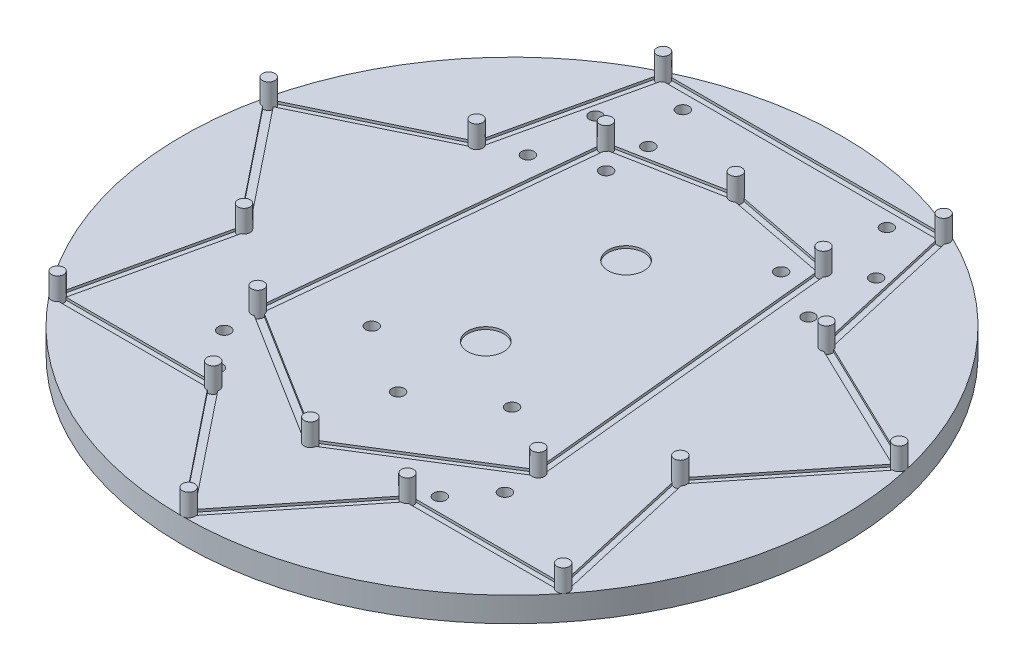
from build123d import *
from build123d.topology import SkipClean

# Parameters (mm, degrees)
SKETCH1_R           = 132.5
BOSS_EXTRUDE1_DEPTH = 10
SKETCH4_R           = 7.27
CUT_EXTRUDE2_DEPTH  = 1
CUT_EXTRUDE3_DEPTH  = 1
SKETCH6_R           = 2.5
BOSS_EXTRUDE2_DEPTH = 10
SKETCH7_R           = 133.4
BOSS_EXTRUDE3_DEPTH = 10
CUT_EXTRUDE4_START  = -1
SKETCH8_R           = 7.27
CUT_EXTRUDE4_DEPTH  = 1
SKETCH9_R           = 2.5
CUT_EXTRUDE5_DEPTH  = 10
CUT_EXTRUDE7_DEPTH  = 5


with BuildPart() as part:
    # Sketch1 → Boss-Extrude1 (new body)
    with BuildSketch(Plane(origin=(0, 0, 0), x_dir=(1, 0, 0), z_dir=(0, 1, 0))):
        with Locations(Location((0, 0, 0), (0, 0, 270))):
            Circle(SKETCH1_R)
    extrude(amount=-BOSS_EXTRUDE1_DEPTH)

    # Sketch4 → Cut-Extrude2 (cut)
    # profile 1 of 3: a face of its own
    with BuildSketch(Plane(origin=(0, 0, 0), x_dir=(1, 0, 0), z_dir=(0, 1, 0))):
        with BuildLine():
            Line((-0.5, -46.614501577), (-0.5, -123.363728943))
            ThreePointArc((-0.5, -123.363728943), (-26.039072114, -102.098724898), (-54.697575203, -118.92533484))
            ThreePointArc((-54.697575203, -118.92533484), (-54.449714233, -119.587577197), (-53.787471876, -119.339716227))
            ThreePointArc((-53.787471876, -119.339716227), (-22.483094979, -103.636494999), (-0.5, -130.9))
            ThreePointArc((-0.5, -130.9), (0, -131.4), (0.5, -130.9))
            ThreePointArc((0.5, -130.9), (22.483094979, -103.636494999), (53.787471876, -119.339716227))
            ThreePointArc((53.787471876, -119.339716227), (54.449714233, -119.587577197), (54.697575203, -118.92533484))
            ThreePointArc((54.697575203, -118.92533484), (26.039072114, -102.098724898), (0.5, -123.363728943))
            Line((0.5, -123.363728943), (0.5, -46.614501577))
            Line((0.5, -46.614501577), (56.79538145, -46.614501577))
            ThreePointArc((56.79538145, -46.614501577), (57.29538145, -46.114501577), (56.79538145, -45.614501577))
            Line((56.79538145, -45.614501577), (0.5, -45.614501577))
            Line((0.5, -45.614501577), (0.5, -11.112006373))
            ThreePointArc((0.5, -11.112006373), (51.771861801, 21.636640783), (44.671501815, 82.059009084))
            ThreePointArc((44.671501815, 82.059009084), (54.047347169, 98.919858711), (57.29538145, 117.936824808))
            ThreePointArc((57.29538145, 117.936824808), (56.79538145, 118.436824808), (56.29538145, 117.936824808))
            ThreePointArc((56.29538145, 117.936824808), (53.139078659, 99.351661589), (44.024097981, 82.850520221))
            ThreePointArc((44.024097981, 82.850520221), (0, 103.47657481), (-44.024097981, 82.850520221))
            ThreePointArc((-44.024097981, 82.850520221), (-53.139078659, 99.351661589), (-56.29538145, 117.936824808))
            ThreePointArc((-56.29538145, 117.936824808), (-56.79538145, 118.436824808), (-57.29538145, 117.936824808))
            ThreePointArc((-57.29538145, 117.936824808), (-54.047347169, 98.919858711), (-44.671501815, 82.059009084))
            ThreePointArc((-44.671501815, 82.059009084), (-51.771861801, 21.636640783), (-0.5, -11.112006373))
            Line((-0.5, -11.112006373), (-0.5, -45.614501577))
            Line((-0.5, -45.614501577), (-56.79538145, -45.614501577))
            ThreePointArc((-56.79538145, -45.614501577), (-57.29538145, -46.114501577), (-56.79538145, -46.614501577))
            Line((-56.79538145, -46.614501577), (-0.5, -46.614501577))
        make_face()
        with BuildLine():
            ThreePointArc((56.29538145, 46.18119336), (-18.585163219, -6.9578853), (-44.024097981, 81.267497947))
            ThreePointArc((-44.024097981, 81.267497947), (-43.704578003, 81.664708324), (-43.381474289, 82.059009084))
            ThreePointArc((-43.381474289, 82.059009084), (0, 102.47657481), (43.381474289, 82.059009084))
            ThreePointArc((43.381474289, 82.059009084), (43.704578003, 81.664708324), (44.024097981, 81.267497947))
            ThreePointArc((44.024097981, 81.267497947), (53.139078659, 64.766356579), (56.29538145, 46.18119336))
        make_face(mode=Mode.SUBTRACT)
    # profile 2 of 3: a face of its own
    with BuildSketch(Plane(origin=(0, 0, 0), x_dir=(1, 0, 0), z_dir=(0, 1, 0))):
        with BuildLine():
            ThreePointArc((-43.381474289, 82.059009084), (-43.704578003, 81.664708324), (-44.024097981, 81.267497947))
            ThreePointArc((-44.024097981, 81.267497947), (0, 60.641443358), (44.024097981, 81.267497947))
            ThreePointArc((44.024097981, 81.267497947), (43.704578003, 81.664708324), (43.381474289, 82.059009084))
            ThreePointArc((43.381474289, 82.059009084), (0, 61.641443358), (-43.381474289, 82.059009084))
        make_face()
    # profile 3 of 3: a face of its own
    with BuildSketch(Plane(origin=(0, 0, 0), x_dir=(1, 0, 0), z_dir=(0, 1, 0))):
        with Locations(Location((0, 46.18119336, 0), (0, 0, 270))):
            Circle(SKETCH4_R)
    extrude(amount=-CUT_EXTRUDE2_DEPTH, mode=Mode.SUBTRACT)

    # Sketch5 → Cut-Extrude3 (cut)
    # profile 1 of 8: a face of its own
    with BuildSketch(Plane(origin=(0, 0, 0), x_dir=(1, 0, 0), z_dir=(0, 1, 0))):
        with BuildLine():
            ThreePointArc((0.5, -130.9), (0.4233621, -131.166016038), (0.21694187, -131.350484434))
            Line((0.21694187, -131.350484434), (46.035485479, -109.285436761))
            ThreePointArc((46.035485479, -109.285436761), (45.600159712, -108.937390671), (45.157967719, -108.598110778))
            Line((45.157967719, -108.598110778), (1.756759395, -129.499031132))
            Line((1.756759395, -129.499031132), (22.359897198, -103.663513495))
            ThreePointArc((22.359897198, -103.663513495), (21.555744487, -103.854317914), (20.757596694, -104.068859305))
            Line((20.757596694, -104.068859305), (0.539181887, -129.421949563))
            ThreePointArc((0.539181887, -129.421949563), (0.523291896, -129.760246656), (0.511509831, -130.098711716))
            ThreePointArc((0.511509831, -130.098711716), (0.502877606, -130.499314528), (0.5, -130.9))
        make_face()
    # profile 2 of 8: a face of its own
    with BuildSketch(Plane(origin=(0, 0, 0), x_dir=(1, 0, 0), z_dir=(0, 1, 0))):
        with BuildLine():
            Line((-46.035485479, -109.285436761), (-0.21694187, -131.350484434))
            ThreePointArc((-0.21694187, -131.350484434), (-0.4233621, -131.166016038), (-0.5, -130.9))
            ThreePointArc((-0.5, -130.9), (-0.509797192, -130.160715157), (-0.539181887, -129.421949562))
            Line((-0.539181887, -129.421949562), (-20.757596693, -104.068859305))
            ThreePointArc((-20.757596693, -104.068859305), (-21.555744486, -103.854317915), (-22.359897197, -103.663513495))
            Line((-22.359897197, -103.663513495), (-1.756759395, -129.499031131))
            Line((-1.756759395, -129.499031131), (-45.157967718, -108.598110777))
            ThreePointArc((-45.157967718, -108.598110777), (-45.600159712, -108.93739067), (-46.035485479, -109.285436761))
        make_face()
    # profile 3 of 8: a face of its own
    with BuildSketch(Plane(origin=(0, 0, 0), x_dir=(1, 0, 0), z_dir=(0, 1, 0))):
        with BuildLine():
            ThreePointArc((46.167760692, -108.111820112), (46.600425974, -108.455914839), (47.026429874, -108.808223092))
            Line((47.026429874, -108.808223092), (102.558682925, -82.065299497))
            ThreePointArc((102.558682925, -82.065299497), (102.732656796, -81.926559964), (102.829205011, -81.72607553))
            Line((102.829205011, -81.72607553), (128.105527661, 29.016729788))
            ThreePointArc((128.105527661, 29.016729788), (128.105527661, 29.239250722), (128.008979446, 29.439735156))
            Line((128.008979446, 29.439735156), (57.186297192, 118.248569709))
            ThreePointArc((57.186297192, 118.248569709), (57.267323116, 118.101964339), (57.29538145, 117.936824808))
            ThreePointArc((57.29538145, 117.936824808), (57.262733912, 116.002906394), (57.164828504, 114.071191915))
            Line((57.164828504, 114.071191915), (70.104183615, 57.380173272))
            Line((70.104183615, 57.380173272), (54.083403044, 65.095374568))
            ThreePointArc((54.083403044, 65.095374568), (54.309978412, 64.434603464), (54.528481058, 63.771119143))
            Line((54.528481058, 63.771119143), (70.388798746, 56.133192914))
            Line((70.388798746, 56.133192914), (87.773396172, -20.033704763))
            Line((87.773396172, -20.033704763), (39.062836749, -81.114814305))
            Line((39.062836749, -81.114814305), (0.5, -81.114814304))
            Line((0.5, -81.114814304), (0.5, -82.114815063))
            Line((0.5, -82.114815063), (38.265362755, -82.114815063))
            Line((38.265362755, -82.114815063), (21.796244886, -102.766435667))
            ThreePointArc((21.796244886, -102.766435667), (22.559551582, -102.598186267), (23.327129481, -102.450642574))
            Line((23.327129481, -102.450642574), (39.544410763, -82.114815063))
            Line((39.544410763, -82.114815063), (100.151097921, -82.114815064))
            Line((100.151097921, -82.114815064), (46.167760692, -108.111820112))
        make_face()
        Polygon((88.05801113, -21.280684366), (101.714760886, -81.114814305), (40.341884756, -81.114814305), align=None, mode=Mode.SUBTRACT)
        Polygon((126.643135792, 27.103531585), (102.341741055, -79.36783546), (88.855484425, -20.280684484), align=None, mode=Mode.SUBTRACT)
        Polygon((71.541181117, 55.578234829), (126.836232281, 28.949542394), (88.570869467, -19.03370488), align=None, mode=Mode.SUBTRACT)
        Polygon((57.770309363, 115.912366139), (125.861304301, 30.528959133), (71.256565992, 56.825215168), align=None, mode=Mode.SUBTRACT)
    # profile 4 of 8: a face of its own
    with BuildSketch(Plane(origin=(0, 0, 0), x_dir=(1, 0, 0), z_dir=(0, 1, 0))):
        with BuildLine():
            Line((-102.558682925, -82.065299497), (-47.026429874, -108.808223092))
            ThreePointArc((-47.026429874, -108.808223092), (-46.600425974, -108.455914839), (-46.167760691, -108.111820111))
            Line((-46.167760691, -108.111820111), (-100.151097921, -82.114815062))
            Line((-100.151097921, -82.114815062), (-39.544410763, -82.114815062))
            Line((-39.544410763, -82.114815062), (-23.327129481, -102.450642575))
            ThreePointArc((-23.327129481, -102.450642575), (-22.559551581, -102.598186267), (-21.796244885, -102.766435667))
            Line((-21.796244885, -102.766435667), (-38.265362755, -82.114815062))
            Line((-38.265362755, -82.114815062), (-0.5, -82.114815063))
            Line((-0.5, -82.114815063), (-0.5, -81.114814304))
            Line((-0.5, -81.114814304), (-39.062836749, -81.114814304))
            Line((-39.062836749, -81.114814304), (-87.773395956, -20.033705033))
            Line((-87.773395956, -20.033705033), (-70.388799193, 56.133193365))
            Line((-70.388799193, 56.133193365), (-54.528480721, 63.771120189))
            ThreePointArc((-54.528480721, 63.771120189), (-54.309978238, 64.434603982), (-54.083403045, 65.095374563))
            Line((-54.083403045, 65.095374563), (-70.10418425, 57.380172961))
            Line((-70.10418425, 57.380172961), (-57.164828774, 114.071195902))
            ThreePointArc((-57.164828774, 114.071195902), (-57.26273398, 116.002908391), (-57.29538145, 117.936824808))
            ThreePointArc((-57.29538145, 117.936824808), (-57.267323116, 118.101964339), (-57.186297192, 118.248569709))
            Line((-57.186297192, 118.248569709), (-128.008979446, 29.439735156))
            ThreePointArc((-128.008979446, 29.439735156), (-128.105527661, 29.239250722), (-128.105527661, 29.016729788))
            Line((-128.105527661, 29.016729788), (-102.829205011, -81.72607553))
            ThreePointArc((-102.829205011, -81.72607553), (-102.732656796, -81.926559964), (-102.558682925, -82.065299497))
        make_face()
        Polygon((-40.341884757, -81.114814304), (-101.714759945, -81.114814303), (-88.058010903, -21.280684649), align=None, mode=Mode.SUBTRACT)
        Polygon((-102.341741455, -79.367833707), (-126.643135792, 27.103531586), (-88.855485508, -20.280683124), align=None, mode=Mode.SUBTRACT)
        Polygon((-88.57087056, -19.033703508), (-126.836232219, 28.949542318), (-71.541183372, 55.578234393), align=None, mode=Mode.SUBTRACT)
        Polygon((-125.861304387, 30.528959085), (-57.770311988, 115.912366734), (-71.256568429, 56.82521399), align=None, mode=Mode.SUBTRACT)
    # profile 5 of 8: a face of its own
    with BuildSketch(Plane(origin=(0, 0, 0), x_dir=(1, 0, 0), z_dir=(0, 1, 0))):
        with BuildLine():
            ThreePointArc((56.29538145, 117.936824808), (56.44182806, 118.290378199), (56.79538145, 118.436824808))
            Line((56.79538145, 118.436824808), (-56.79538145, 118.436824808))
            ThreePointArc((-56.79538145, 118.436824808), (-56.44182806, 118.290378199), (-56.29538145, 117.936824808))
            ThreePointArc((-56.29538145, 117.936824808), (-56.293965699, 117.53757729), (-56.289718514, 117.138349853))
            Line((-56.289718514, 117.138349853), (-20.245595281, 99.780415437))
            ThreePointArc((-20.245595281, 99.780415437), (-19.590627593, 100.023259127), (-18.932747917, 100.258099631))
            Line((-18.932747917, 100.258099631), (-54.604738317, 117.436824808))
            Line((-54.604738317, 117.436824808), (54.604738317, 117.436824808))
            Line((54.604738317, 117.436824808), (18.932747919, 100.25809963))
            ThreePointArc((18.932747919, 100.25809963), (19.59062648, 100.023259532), (20.245593063, 99.780416274))
            Line((20.245593063, 99.780416274), (56.289718548, 117.138352268))
            ThreePointArc((56.289718548, 117.138352268), (56.293965707, 117.537578498), (56.29538145, 117.936824808))
        make_face()
    # profile 6 of 8: a face of its own
    with BuildSketch(Plane(origin=(0, 0, 0), x_dir=(1, 0, 0), z_dir=(0, 1, 0))):
        with BuildLine():
            Line((1.152382431, 90.585610641), (18.991419399, 99.17643807))
            ThreePointArc((18.991419399, 99.17643807), (18.320815411, 99.411989853), (17.64729092, 99.639056166))
            Line((17.64729092, 99.639056166), (2e-09, 91.140568769))
            Line((2e-09, 91.140568769), (-17.647290918, 99.639056167))
            ThreePointArc((-17.647290918, 99.639056167), (-18.320816539, 99.411989465), (-18.991421647, 99.176437264))
            Line((-18.991421647, 99.176437264), (-1.152384136, 90.585609817))
            Line((-1.152384136, 90.585609817), (-35.344350552, 74.119626624))
            ThreePointArc((-35.344350552, 74.119626624), (-34.909775908, 73.772613973), (-34.471794488, 73.429911217))
            Line((-34.471794488, 73.429911217), (-1.691e-06, 90.030651696))
            Line((-1.691e-06, 90.030651696), (34.471793567, 73.429910504))
            ThreePointArc((34.471793567, 73.429910504), (34.909775452, 73.772613612), (35.344350555, 74.119626626))
            Line((35.344350555, 74.119626626), (1.152382431, 90.585610641))
        make_face()
    # profile 7 of 8: a face of its own
    with BuildSketch(Plane(origin=(0, 0, 0), x_dir=(1, 0, 0), z_dir=(0, 1, 0))):
        with BuildLine():
            ThreePointArc((53.274307424, 64.375097316), (53.040354297, 65.046261308), (52.797946045, 65.714418032))
            Line((52.797946045, 65.714418032), (36.339735415, 73.640274542))
            ThreePointArc((36.339735415, 73.640274542), (35.909841923, 73.291063659), (35.476592847, 72.946024687))
            Line((35.476592847, 72.946024687), (53.274307424, 64.375097316))
        make_face()
    # profile 8 of 8: a face of its own
    with BuildSketch(Plane(origin=(0, 0, 0), x_dir=(1, 0, 0), z_dir=(0, 1, 0))):
        with BuildLine():
            Line((-36.339735412, 73.64027454), (-52.797946047, 65.714418027))
            ThreePointArc((-52.797946047, 65.714418027), (-53.040354107, 65.046261842), (-53.274307056, 64.375098394))
            Line((-53.274307056, 64.375098394), (-35.476593747, 72.946025397))
            ThreePointArc((-35.476593747, 72.946025397), (-35.909842369, 73.291064018), (-36.339735412, 73.64027454))
        make_face()
    extrude(amount=-CUT_EXTRUDE3_DEPTH, mode=Mode.SUBTRACT)

    # Sketch6 → Boss-Extrude2 (add)
    with BuildSketch(Plane(origin=(0, -1, 0), x_dir=(1, 0, 0), z_dir=(0, 1, 0))):
        with Locations(Location((-127.618063705, 29.127990255, 0), (0, 0, 116.51554643))):
            Circle(SKETCH6_R)
        with Locations(Location((-102.341741055, -81.614815063, 0), (0, 0, 88.679834483))):
            Circle(SKETCH6_R)
        with Locations(Location((0, -130.9, 0), (0, 0, 104.019786173))):
            Circle(SKETCH6_R)
        with Locations(Location((102.341741055, -81.614815063, 0), (0, 0, 91.320183824))):
            Circle(SKETCH6_R)
        with Locations(Location((127.618063705, 29.127990255, 0), (0, 0, 63.48445357))):
            Circle(SKETCH6_R)
        with Locations(Location((56.79538145, 117.936824808, 0), (0, 0, 114.913024999))):
            Circle(SKETCH6_R)
        with Locations(Location((-56.79538145, 117.936824808, 0), (0, 0, 65.086975001))):
            Circle(SKETCH6_R)
        with Locations(Location((39.303623453, -81.614815063, 0), (0, 0, 62.965530462))):
            Circle(SKETCH6_R)
        with Locations(Location((-39.303623453, -81.614815063, 0), (0, 0, 117.034469525))):
            Circle(SKETCH6_R)
        with Locations(Location((88.314440251, -20.157194682, 0), (0, 0, 91.320183824))):
            Circle(SKETCH6_R)
        with Locations(Location((-88.314440251, -20.157194682, 0), (0, 0, 88.679848556))):
            Circle(SKETCH6_R)
        with Locations(Location((70.822682254, 56.479204427, 0), (0, 0, 91.320183824))):
            Circle(SKETCH6_R)
        with Locations(Location((-70.822682254, 56.479204427, 0), (0, 0, 88.679866104))):
            Circle(SKETCH6_R)
        with Locations(Location((44.028373726, 82.059009084, 0), (0, 0, 63.599440022))):
            Circle(SKETCH6_R)
        with Locations(Location((-44.028373726, 82.059009084, 0), (0, 0, 116.400559978))):
            Circle(SKETCH6_R)
        with Locations(Location((0, 90.585610636, 0), (0, 0, 142.748755212))):
            Circle(SKETCH6_R)
        with Locations(Location((56.79538145, -46.114501577, 0), (0, 0, 168.463040967))):
            Circle(SKETCH6_R)
        with Locations(Location((0, -81.614815063, 0), (0, 0, 101.536959033))):
            Circle(SKETCH6_R)
        with Locations(Location((-56.79538145, -46.114501577, 0), (0, 0, 11.536959033))):
            Circle(SKETCH6_R)
    extrude(amount=BOSS_EXTRUDE2_DEPTH)

    # Sketch7 → Boss-Extrude3 (add)
    with BuildSketch(Plane.XZ.offset(10)):
        with Locations(Location((0, 0, 0), (0, 0, 270))):
            Circle(SKETCH7_R)
    extrude(amount=-BOSS_EXTRUDE3_DEPTH)

    # Sketch8 → Cut-Extrude4 (cut)
    with SkipClean():  # the faces are left unmerged after this step: merging them gives an invalid solid
        with BuildSketch(Plane(origin=(0, 0, 0), x_dir=(1, 0, 0), z_dir=(0, 1, 0)).offset(CUT_EXTRUDE4_START)):
            with BuildLine():
                ThreePointArc((-2.419726827, -130.271571738), (-1.558724505, -128.945421294), (-0.07423238, -128.401102332))
                Line((-0.07423238, -128.401102332), (-36.883896626, -82.243243325))
                ThreePointArc((-36.883896626, -82.243243325), (-37.744898949, -83.569393769), (-39.229391073, -84.113712731))
                Line((-39.229391073, -84.113712731), (-2.419726827, -130.271571738))
            make_face()
            with BuildLine():
                Line((36.883896626, -82.243243325), (0.07423238, -128.401102332))
                ThreePointArc((0.07423238, -128.401102332), (1.558724505, -128.945421294), (2.419726827, -130.271571738))
                Line((2.419726827, -130.271571738), (39.229391073, -84.113712731))
                ThreePointArc((39.229391073, -84.113712731), (37.744898949, -83.569393769), (36.883896626, -82.243243325))
            make_face()
            with BuildLine():
                Line((100.341741055, -80.114815063), (41.303623453, -80.114815063))
                ThreePointArc((41.303623453, -80.114815063), (41.675331698, -80.824245648), (41.803623453, -81.614815063))
                ThreePointArc((41.803623453, -81.614815063), (41.675331698, -82.405384478), (41.303623453, -83.114815063))
                Line((41.303623453, -83.114815063), (100.341741055, -83.114815063))
                ThreePointArc((100.341741055, -83.114815063), (99.841741055, -81.614815063), (100.341741055, -80.114815063))
            make_face()
            with BuildLine():
                Line((87.297090251, -22.440831907), (100.434307319, -79.99874064))
                ThreePointArc((100.434307319, -79.99874064), (101.78543872, -79.177495283), (103.359091055, -79.331177838))
                Line((103.359091055, -79.331177838), (90.221873988, -21.773269105))
                ThreePointArc((90.221873988, -21.773269105), (88.870742586, -22.594514462), (87.297090251, -22.440831907))
            make_face()
            with BuildLine():
                Line((125.198336877, 28.499561993), (88.388672631, -17.658297014))
                ThreePointArc((88.388672631, -17.658297014), (89.873164756, -18.202615976), (90.734167079, -19.52876642))
                Line((90.734167079, -19.52876642), (127.543831325, 26.629092587))
                ThreePointArc((127.543831325, 26.629092587), (126.0593392, 27.173411549), (125.198336877, 28.499561993))
            make_face()
            with BuildLine():
                Line((71.973794381, 54.259983647), (125.16530036, 28.644304431))
                ThreePointArc((125.16530036, 28.644304431), (125.365641535, 30.212699603), (126.466951577, 31.347211035))
                Line((126.466951577, 31.347211035), (73.275445599, 56.962890251))
                ThreePointArc((73.275445599, 56.962890251), (73.310845066, 56.722197882), (73.322682254, 56.479204427))
                ThreePointArc((73.322682254, 56.479204427), (72.959008577, 55.180701504), (71.973794381, 54.259983647))
            make_face()
            with BuildLine():
                Line((55.77803145, 115.653187583), (68.915248518, 58.09527885))
                ThreePointArc((68.915248518, 58.09527885), (70.266379919, 58.916524207), (71.840032254, 58.762841652))
                Line((71.840032254, 58.762841652), (58.702815187, 116.320750385))
                ThreePointArc((58.702815187, 116.320750385), (57.351683785, 115.499505028), (55.77803145, 115.653187583))
            make_face()
            with BuildLine():
                Line((-54.79538145, 116.436824808), (54.79538145, 116.436824808))
                ThreePointArc((54.79538145, 116.436824808), (54.29538145, 117.936824808), (54.79538145, 119.436824808))
                Line((54.79538145, 119.436824808), (-54.79538145, 119.436824808))
                ThreePointArc((-54.79538145, 119.436824808), (-54.423673205, 118.727394223), (-54.29538145, 117.936824808))
                ThreePointArc((-54.29538145, 117.936824808), (-54.423673205, 117.146255393), (-54.79538145, 116.436824808))
            make_face()
            with BuildLine():
                Line((-58.702815187, 116.320750385), (-71.840032254, 58.762841652))
                ThreePointArc((-71.840032254, 58.762841652), (-70.266379919, 58.916524207), (-68.915248518, 58.09527885))
                Line((-68.915248518, 58.09527885), (-55.77803145, 115.653187583))
                ThreePointArc((-55.77803145, 115.653187583), (-57.351683785, 115.499505028), (-58.702815187, 116.320750385))
            make_face()
            with BuildLine():
                Line((-73.275445599, 56.962890251), (-126.466951577, 31.347211035))
                ThreePointArc((-126.466951577, 31.347211035), (-125.481737381, 30.426493178), (-125.118063705, 29.127990255))
                ThreePointArc((-125.118063705, 29.127990255), (-125.129900892, 28.884996799), (-125.16530036, 28.644304431))
                Line((-125.16530036, 28.644304431), (-71.973794381, 54.259983647))
                ThreePointArc((-71.973794381, 54.259983647), (-73.075104424, 55.394495079), (-73.275445599, 56.962890251))
            make_face()
            with BuildLine():
                Line((-127.543831325, 26.629092587), (-90.734167079, -19.52876642))
                ThreePointArc((-90.734167079, -19.52876642), (-89.873164756, -18.202615976), (-88.388672631, -17.658297014))
                Line((-88.388672631, -17.658297014), (-125.198336877, 28.499561993))
                ThreePointArc((-125.198336877, 28.499561993), (-126.0593392, 27.173411549), (-127.543831325, 26.629092587))
            make_face()
            with BuildLine():
                Line((-90.221873988, -21.773269105), (-103.359091055, -79.331177838))
                ThreePointArc((-103.359091055, -79.331177838), (-101.78543872, -79.177495283), (-100.434307319, -79.99874064))
                Line((-100.434307319, -79.99874064), (-87.297090251, -22.440831907))
                ThreePointArc((-87.297090251, -22.440831907), (-88.870742586, -22.594514462), (-90.221873988, -21.773269105))
            make_face()
            with BuildLine():
                Line((-100.341741055, -83.114815063), (-41.303623453, -83.114815063))
                ThreePointArc((-41.303623453, -83.114815063), (-41.803623453, -81.614815063), (-41.303623453, -80.114815063))
                Line((-41.303623453, -80.114815063), (-100.341741055, -80.114815063))
                ThreePointArc((-100.341741055, -80.114815063), (-99.97003281, -80.824245648), (-99.841741055, -81.614815063))
                ThreePointArc((-99.841741055, -81.614815063), (-99.97003281, -82.405384478), (-100.341741055, -83.114815063))
            make_face()
            with BuildLine():
                ThreePointArc((-2.491003605, -81.826713714), (-2.119942075, -80.289731821), (-0.900903714, -79.282783224))
                Line((-0.900903714, -79.282783224), (-54.304377845, -45.902602926))
                ThreePointArc((-54.304377845, -45.902602926), (-54.297631562, -46.008456807), (-54.29538145, -46.114501577))
                ThreePointArc((-54.29538145, -46.114501577), (-54.733554677, -47.528315694), (-55.894477736, -48.446533416))
                Line((-55.894477736, -48.446533416), (-2.491003605, -81.826713714))
            make_face()
            with BuildLine():
                Line((54.304377845, -45.902602926), (0.900903714, -79.282783224))
                ThreePointArc((0.900903714, -79.282783224), (2.061826773, -80.201000946), (2.5, -81.614815063))
                ThreePointArc((2.5, -81.614815063), (2.497749889, -81.720859834), (2.491003605, -81.826713714))
                Line((2.491003605, -81.826713714), (55.894477736, -48.446533416))
                ThreePointArc((55.894477736, -48.446533416), (54.675439376, -47.43958482), (54.304377845, -45.902602926))
            make_face()
            with BuildLine():
                ThreePointArc((-58.089761688, -43.975674842), (-56.5475896, -43.626812047), (-55.104534252, -44.273025064))
                Line((-55.104534252, -44.273025064), (-42.733993489, 79.920182349))
                ThreePointArc((-42.733993489, 79.920182349), (-44.276165577, 79.571319554), (-45.719220925, 80.21753257))
                Line((-45.719220925, 80.21753257), (-58.089761688, -43.975674842))
            make_face()
            with BuildLine():
                ThreePointArc((-41.528373726, 82.059009084), (-41.592005607, 81.498553564), (-41.779662038, 80.966628316))
                Line((-41.779662038, 80.966628316), (-1.67832481, 88.732714031))
                ThreePointArc((-1.67832481, 88.732714031), (-2.454397812, 90.110288238), (-2.248711688, 91.677991405))
                Line((-2.248711688, 91.677991405), (-42.350048916, 83.91190569))
                ThreePointArc((-42.350048916, 83.91190569), (-41.743005919, 83.072465539), (-41.528373726, 82.059009084))
            make_face()
            with BuildLine():
                Line((1.67832481, 88.732714031), (41.779662038, 80.966628316))
                ThreePointArc((41.779662038, 80.966628316), (41.573975914, 82.534331482), (42.350048916, 83.91190569))
                Line((42.350048916, 83.91190569), (2.248711688, 91.677991405))
                ThreePointArc((2.248711688, 91.677991405), (2.436368119, 91.146066156), (2.5, 90.585610636))
                ThreePointArc((2.5, 90.585610636), (2.285367807, 89.572154181), (1.67832481, 88.732714031))
            make_face()
            with BuildLine():
                Line((42.733993489, 79.920182349), (55.104534252, -44.273025064))
                ThreePointArc((55.104534252, -44.273025064), (56.5475896, -43.626812047), (58.089761688, -43.975674842))
                Line((58.089761688, -43.975674842), (45.719220925, 80.21753257))
                ThreePointArc((45.719220925, 80.21753257), (44.276165577, 79.571319554), (42.733993489, 79.920182349))
            make_face()
            with Locations(Location((0, 46.18119336, 0), (0, 0, 270))):
                Circle(SKETCH8_R)
            with Locations(Location((0, -10.614188091, 0), (0, 0, 270))):
                Circle(SKETCH8_R)
        extrude(amount=CUT_EXTRUDE4_DEPTH, mode=Mode.SUBTRACT)

    # Sketch9 → Cut-Extrude5 (cut)
    with SkipClean():  # the faces are left unmerged after this step: merging them gives an invalid solid
        with BuildSketch(Plane(origin=(0, 0, 0), x_dir=(1, 0, 0), z_dir=(0, 1, 0))):
            with Locations(Location((45.122270201, -74.318462823, 0), (0, 0, 270))):
                Circle(SKETCH9_R)
            with Locations(Location((56.79538145, -59.680844299, 0), (0, 0, 270))):
                Circle(SKETCH9_R)
            with Locations(Location((-45.122270201, -74.318462823, 0), (0, 0, 270))):
                Circle(SKETCH9_R)
            with Locations(Location((-56.79538145, -59.680844299, 0), (0, 0, 270))):
                Circle(SKETCH9_R)
            with Locations(Location((-35.411341127, 73.532407532, 0), (0, 0, 270))):
                Circle(SKETCH9_R)
            with Locations(Location((-56.79538145, 63.234396464, 0), (0, 0, 270))):
                Circle(SKETCH9_R)
            with Locations(Location((-35.411341127, 90.585610636, 0), (0, 0, 270))):
                Circle(SKETCH9_R)
            with Locations(Location((-56.79538145, 90.585610636, 0), (0, 0, 270))):
                Circle(SKETCH9_R)
            with Locations(Location((35.411341127, 90.585610636, 0), (0, 0, 270))):
                Circle(SKETCH9_R)
            with Locations(Location((56.79538145, 90.585610636, 0), (0, 0, 270))):
                Circle(SKETCH9_R)
            with Locations(Location((56.79538145, 63.234396464, 0), (0, 0, 270))):
                Circle(SKETCH9_R)
            with Locations(Location((41.293428594, 110.471477771, 0), (0, 0, 270))):
                Circle(SKETCH9_R)
            with Locations(Location((-41.293428594, 110.471477771, 0), (0, 0, 270))):
                Circle(SKETCH9_R)
            with Locations(Location((35.411341127, 73.532407532, 0), (0, 0, 270))):
                Circle(SKETCH9_R)
            with Locations(Location((28.397690725, -28.364344834, 0), (0, 0, 270))):
                Circle(SKETCH9_R)
            with Locations(Location((0, -46.114501577, 0), (0, 0, 270))):
                Circle(SKETCH9_R)
            with Locations(Location((-28.397690725, -28.364344834, 0), (0, 0, 270))):
                Circle(SKETCH9_R)
        extrude(amount=-CUT_EXTRUDE5_DEPTH, mode=Mode.SUBTRACT)

    # Sketch10 → Cut-Extrude7 (cut)
    with SkipClean():  # the faces are left unmerged after this step: merging them gives an invalid solid
        with BuildSketch(Plane.XZ.offset(10)):
            with BuildLine():
                ThreePointArc((-3.515135175, 94.117810519), (-25.00692596, 89.432324375), (-43.870246632, 78.117467558))
                ThreePointArc((-43.870246632, 78.117467558), (-47.863283156, 77.231682344), (-48.990426838, 73.299952031))
                ThreePointArc((-48.990426838, 73.299952031), (-53.04537718, 68.66362274), (-56.663152679, 63.678658145))
                ThreePointArc((-56.663152679, 63.678658145), (-58.909480669, 56.285172864), (-53.266305635, 61.563827009))
                ThreePointArc((-53.266305635, 61.563827009), (-49.91805125, 66.169663533), (-46.172749357, 70.458865234))
                ThreePointArc((-46.172749357, 70.458865234), (-42.381257246, 71.405243301), (-41.205898203, 75.132115313))
                ThreePointArc((-41.205898203, 75.132115313), (-23.532625801, 85.713932378), (-3.409870843, 90.117810519))
                ThreePointArc((-3.409870843, 90.117810519), (0, 90.29585433), (3.409870843, 90.117810519))
                ThreePointArc((3.409870843, 90.117810519), (23.532625801, 85.713932378), (41.205898203, 75.132115313))
                ThreePointArc((41.205898203, 75.132115313), (42.381257246, 71.405243301), (46.172749357, 70.458865234))
                ThreePointArc((46.172749357, 70.458865234), (49.91805125, 66.169663533), (53.266305635, 61.563827009))
                ThreePointArc((53.266305635, 61.563827009), (53.326628418, 57.688922514), (56.642923049, 55.6837508))
                ThreePointArc((56.642923049, 55.6837508), (49.362958837, 13.885816882), (7.584436271, 6.495268122))
                ThreePointArc((7.584436271, 6.495268122), (6.956085733, 7.047781773), (6.724776182, 7.851890986))
                ThreePointArc((6.724776182, 7.851890986), (-5.254829704, 15.638097404), (3.061513091, 4.020248631))
                ThreePointArc((3.061513091, 4.020248631), (3.619315918, 3.979520011), (4.124643409, 3.739839092))
                ThreePointArc((4.124643409, 3.739839092), (33.571763837, -24.89196201), (53.710950667, -60.687577518))
                ThreePointArc((53.710950667, -60.687577518), (53.010324428, -64.527974191), (55.914852334, -67.136276585))
                ThreePointArc((55.914852334, -67.136276585), (57.178419079, -76.91000355), (55.914852334, -86.683730516))
                ThreePointArc((55.914852334, -86.683730516), (53.03114008, -89.232655756), (53.632366309, -93.034147999))
                ThreePointArc((53.632366309, -93.034147999), (49.056846465, -100.538242883), (42.896111533, -106.806589314))
                ThreePointArc((42.896111533, -106.806589314), (39.312627207, -106.99636254), (37.323362873, -109.983033128))
                ThreePointArc((37.323362873, -109.983033128), (0, -117.236305874), (-37.323362873, -109.983033128))
                ThreePointArc((-37.323362873, -109.983033128), (-39.312627207, -106.99636254), (-42.896111533, -106.806589314))
                ThreePointArc((-42.896111533, -106.806589314), (-49.056846465, -100.538242883), (-53.632366309, -93.034147999))
                ThreePointArc((-53.632366309, -93.034147999), (-53.03114008, -89.232655756), (-55.914852334, -86.683730516))
                ThreePointArc((-55.914852334, -86.683730516), (-57.178419079, -76.91000355), (-55.914852334, -67.136276585))
                ThreePointArc((-55.914852334, -67.136276585), (-55.604974412, -59.415636052), (-59.737123757, -65.944775073))
                ThreePointArc((-59.737123757, -65.944775073), (-61.178419079, -76.91000355), (-59.737123757, -87.875232027))
                ThreePointArc((-59.737123757, -87.875232027), (-60.559622821, -91.938565516), (-57.338577627, -94.548556247))
                ThreePointArc((-57.338577627, -94.548556247), (-52.211549772, -102.997479969), (-45.26912628, -110.031218857))
                ThreePointArc((-45.26912628, -110.031218857), (-43.272676167, -113.947478208), (-38.885925827, -113.665836929))
                ThreePointArc((-38.885925827, -113.665836929), (0, -121.236305874), (38.885925827, -113.665836929))
                ThreePointArc((38.885925827, -113.665836929), (43.272676167, -113.947478208), (45.26912628, -110.031218857))
                ThreePointArc((45.26912628, -110.031218857), (52.211549772, -102.997479969), (57.338577627, -94.548556247))
                ThreePointArc((57.338577627, -94.548556247), (60.559622821, -91.938565516), (59.737123757, -87.875232027))
                ThreePointArc((59.737123757, -87.875232027), (61.178419079, -76.91000355), (59.737123757, -65.944775073))
                ThreePointArc((59.737123757, -65.944775073), (60.579804091, -61.938963997), (57.459098207, -59.289845784))
                ThreePointArc((57.459098207, -59.289845784), (40.233417453, -27.181062116), (15.667619196, -0.269733237))
                ThreePointArc((15.667619196, -0.269733237), (55.648607114, 14.998037804), (60.183173349, 57.554141204))
                ThreePointArc((60.183173349, 57.554141204), (60.263392373, 61.674057845), (56.663152679, 63.678658145))
                ThreePointArc((56.663152679, 63.678658145), (53.04537718, 68.66362274), (48.990426838, 73.299952031))
                ThreePointArc((48.990426838, 73.299952031), (47.863283156, 77.231682344), (43.870246632, 78.117467558))
                ThreePointArc((43.870246632, 78.117467558), (25.00692596, 89.432324375), (3.515135175, 94.117810519))
                ThreePointArc((3.515135175, 94.117810519), (0, 94.336060324), (-3.515135175, 94.117810519))
            make_face()
            with BuildLine():
                ThreePointArc((28.461970954, 32.363828307), (17.804445524, 43.007863436), (3.567020269, 47.924575167))
                ThreePointArc((3.567020269, 47.924575167), (0, 50.114501577), (-3.567020269, 47.924575167))
                ThreePointArc((-3.567020269, 47.924575167), (-17.804445524, 43.007863436), (-28.461970954, 32.363828307))
                ThreePointArc((-28.461970954, 32.363828307), (-31.971641556, 30.160695428), (-31.64566275, 26.029676179))
                ThreePointArc((-31.64566275, 26.029676179), (-34.112110328, -13.066960386), (-11.967044926, -45.381452997))
                ThreePointArc((-11.967044926, -45.381452997), (-27.018624491, -54.649563516), (-36.370653398, -69.64914602))
                ThreePointArc((-36.370653398, -69.64914602), (-39.30161424, -72.601937164), (-38.023905727, -76.561352267))
                ThreePointArc((-38.023905727, -76.561352267), (-38.416851325, -82.059009084), (-38.023905727, -87.556665901))
                ThreePointArc((-38.023905727, -87.556665901), (-34.665805712, -94.515518644), (-34.089599675, -86.810296142))
                ThreePointArc((-34.089599675, -86.810296142), (-34.416851325, -82.059009084), (-34.089599675, -77.307722026))
                ThreePointArc((-34.089599675, -77.307722026), (-31.521068014, -74.462877899), (-32.524413224, -70.763716996))
                ThreePointArc((-32.524413224, -70.763716996), (-27.45126905, -61.219973743), (-19.684739947, -53.703268829))
                ThreePointArc((-19.684739947, -53.703268829), (-13.877937061, -70.778576791), (4.063414653, -68.936566901))
                ThreePointArc((4.063414653, -68.936566901), (18.607142166, -63.769879551), (31.955862291, -71.517546243))
                ThreePointArc((31.955862291, -71.517546243), (31.778736648, -75.206977536), (34.699150272, -77.468494953))
                ThreePointArc((34.699150272, -77.468494953), (35.282051347, -82.059009084), (34.699150272, -86.649523215))
                ThreePointArc((34.699150272, -86.649523215), (34.052148866, -94.34760431), (38.474855026, -88.013669231))
                ThreePointArc((38.474855026, -88.013669231), (39.282051347, -82.059009084), (38.474855026, -76.104348937))
                ThreePointArc((38.474855026, -76.104348937), (39.043945606, -71.857837527), (35.445366494, -69.53255225))
                ThreePointArc((35.445366494, -69.53255225), (19.163429356, -59.805064894), (1.264657929, -66.078777405))
                ThreePointArc((1.264657929, -66.078777405), (-15.21565713, -63.688160378), (-8.557985911, -48.424109535))
                ThreePointArc((-8.557985911, -48.424109535), (-7.284956542, -48.755223682), (-6.364493551, -49.694898219))
                ThreePointArc((-6.364493551, -49.694898219), (7.263906078, -46.478797938), (-6.055730123, -42.158627924))
                ThreePointArc((-6.055730123, -42.158627924), (-7.361937343, -43.019387624), (-8.888225129, -42.676560909))
                ThreePointArc((-8.888225129, -42.676560909), (-30.124020217, -12.474684571), (-27.997751005, 24.384389028))
                ThreePointArc((-27.997751005, 24.384389028), (-24.824843735, 26.565799759), (-24.962601986, 30.413775329))
                ThreePointArc((-24.962601986, 30.413775329), (-15.684312335, 39.615956116), (-3.347270876, 43.924575167))
                ThreePointArc((-3.347270876, 43.924575167), (0, 42.114501577), (3.347270876, 43.924575167))
                ThreePointArc((3.347270876, 43.924575167), (15.684312335, 39.615956116), (24.962601986, 30.413775329))
                ThreePointArc((24.962601986, 30.413775329), (30.344807609, 24.870244686), (28.461970954, 32.363828307))
            make_face()
        extrude(amount=-CUT_EXTRUDE7_DEPTH, mode=Mode.SUBTRACT)


solid = part.part
